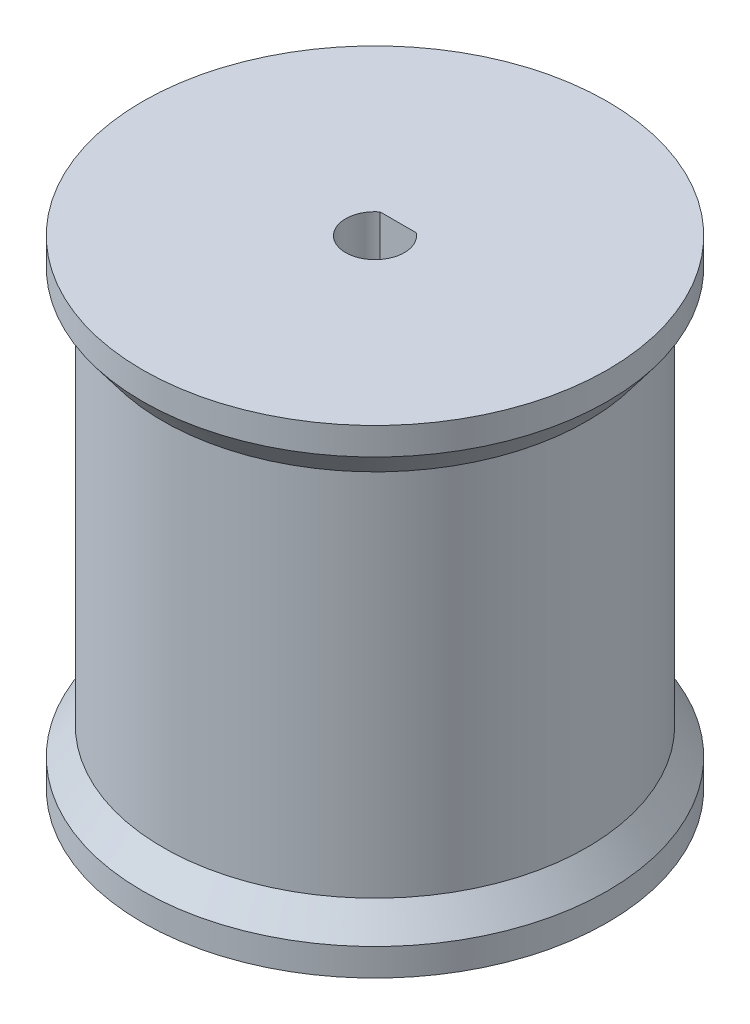
from build123d import *

# Parameters (mm, degrees)
CUT_EXTRUDE1_DEPTH = 8.2


with BuildPart() as part:
    # Sketch1 → Revolve1 (revolve)
    with BuildSketch(Plane.XY, mode=Mode.PRIVATE) as revolve1_sk:
        Polygon((0, 0), (0, 35), (-17, 35), (-17, 33), (-15.5, 31), (-15.5, 4), (-17, 2), (-17, 0), align=None)
    revolve(revolve1_sk.sketch.rotate(Axis((0, 0, 0), (0, 1, 0)), 270), axis=Axis((0, 0, 0), (0, 1, 0)))

    # Sketch2 → Cut-Extrude1 (cut)
    with BuildSketch(Plane(origin=(0, 35, 0), x_dir=(1, 0, 0), z_dir=(0, 1, 0))):
        with BuildLine():
            Line((-1.325, 1.693184869), (1.325, 1.693184869))
            ThreePointArc((1.325, 1.693184869), (0, -2.15), (-1.325, 1.693184869))
        make_face()
    extrude(amount=-CUT_EXTRUDE1_DEPTH, mode=Mode.SUBTRACT)


solid = part.part
